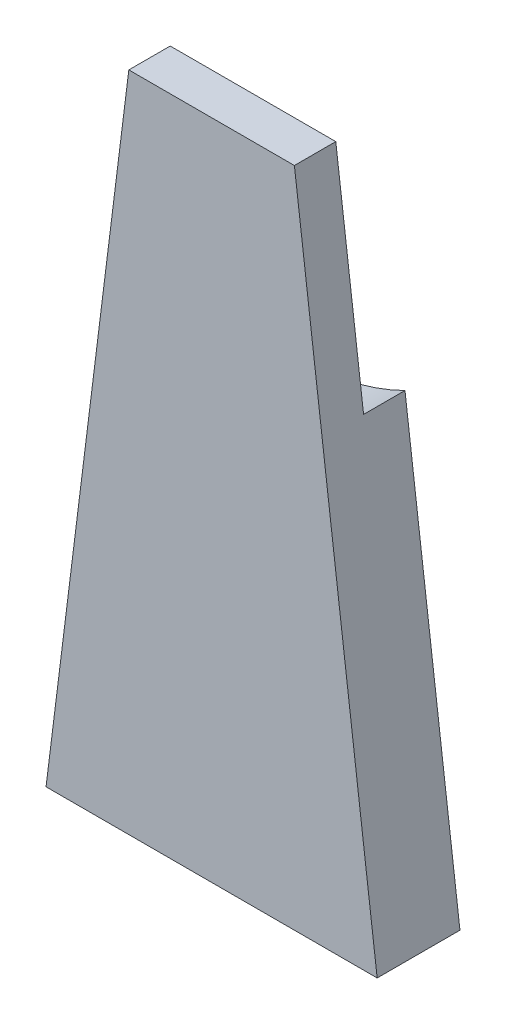
from build123d import *

# Parameters (mm, degrees)
BOSS_EXTRUDE1_DEPTH = 5
BOSS_EXTRUDE2_DEPTH = 5


with BuildPart() as part:
    # Sketch1 → Boss-Extrude1 (new body)
    with BuildSketch(Plane.XY):
        Polygon((-10, 0), (10, 0), (20, -80), (-20, -80), align=None)
    extrude(amount=BOSS_EXTRUDE1_DEPTH)

    # Sketch2 → Boss-Extrude2 (add)
    with BuildSketch(Plane.XY):
        with BuildLine():
            Line((20, -80), (13.357757603, -26.862060826))
            ThreePointArc((13.357757603, -26.862060826), (0, -30), (-13.357757603, -26.862060826))
            Line((-13.357757603, -26.862060826), (-20, -80))
            Line((-20, -80), (20, -80))
        make_face()
    extrude(amount=-BOSS_EXTRUDE2_DEPTH)


solid = part.part
